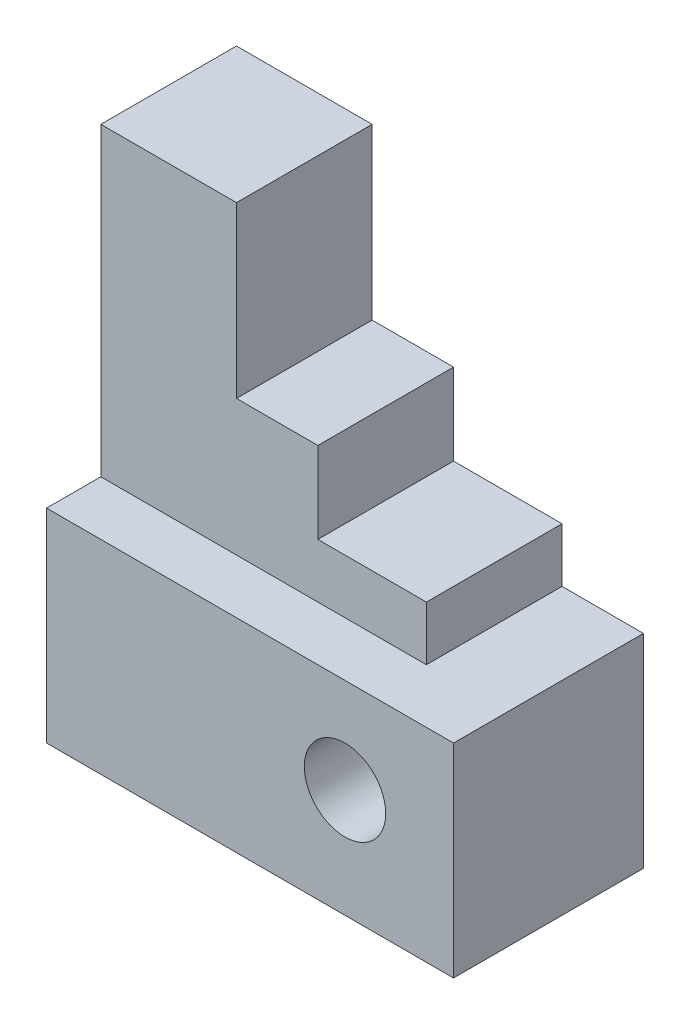
from build123d import *

# Parameters (mm, degrees)
SKETCH1_W           = 60
SKETCH1_H           = 28
BOSS_EXTRUDE1_DEPTH = 30
SKETCH2_W           = 48
SKETCH2_H           = 20
BOSS_EXTRUDE2_DEPTH = 8
SKETCH3_W           = 32
SKETCH3_H           = 20
BOSS_EXTRUDE3_DEPTH = 12
SKETCH4_W           = 20
SKETCH4_H           = 20
BOSS_EXTRUDE4_DEPTH = 25
SKETCH5_R           = 6
CUT_EXTRUDE1_DEPTH  = 86.492689746


with BuildPart() as part:
    # Sketch1 → Boss-Extrude1 (new body)
    with BuildSketch(Plane(origin=(0, 0, 0), x_dir=(1, 0, 0), z_dir=(0, 1, 0))):
        with Locations((0, 14)):
            Rectangle(SKETCH1_W, SKETCH1_H)
    extrude(amount=BOSS_EXTRUDE1_DEPTH)

    # Sketch2 → Boss-Extrude2 (add)
    with BuildSketch(Plane(origin=(0, 30, 0), x_dir=(1, 0, 0), z_dir=(0, 1, 0))):
        with Locations((-6, 18)):
            Rectangle(SKETCH2_W, SKETCH2_H)
    extrude(amount=BOSS_EXTRUDE2_DEPTH)

    # Sketch3 → Boss-Extrude3 (add)
    with BuildSketch(Plane(origin=(0, 38, 0), x_dir=(1, 0, 0), z_dir=(0, 1, 0))):
        with Locations((-14, 18)):
            Rectangle(SKETCH3_W, SKETCH3_H)
    extrude(amount=BOSS_EXTRUDE3_DEPTH)

    # Sketch4 → Boss-Extrude4 (add)
    with BuildSketch(Plane(origin=(0, 50, 0), x_dir=(1, 0, 0), z_dir=(0, 1, 0))):
        with Locations((-20, 18)):
            Rectangle(SKETCH4_W, SKETCH4_H)
    extrude(amount=BOSS_EXTRUDE4_DEPTH)

    # Sketch5 → Cut-Extrude1 (cut, through all)
    with BuildSketch(Plane.XY):
        with Locations((14, 16)):
            Circle(SKETCH5_R)
    extrude(amount=-CUT_EXTRUDE1_DEPTH, mode=Mode.SUBTRACT)


solid = part.part
